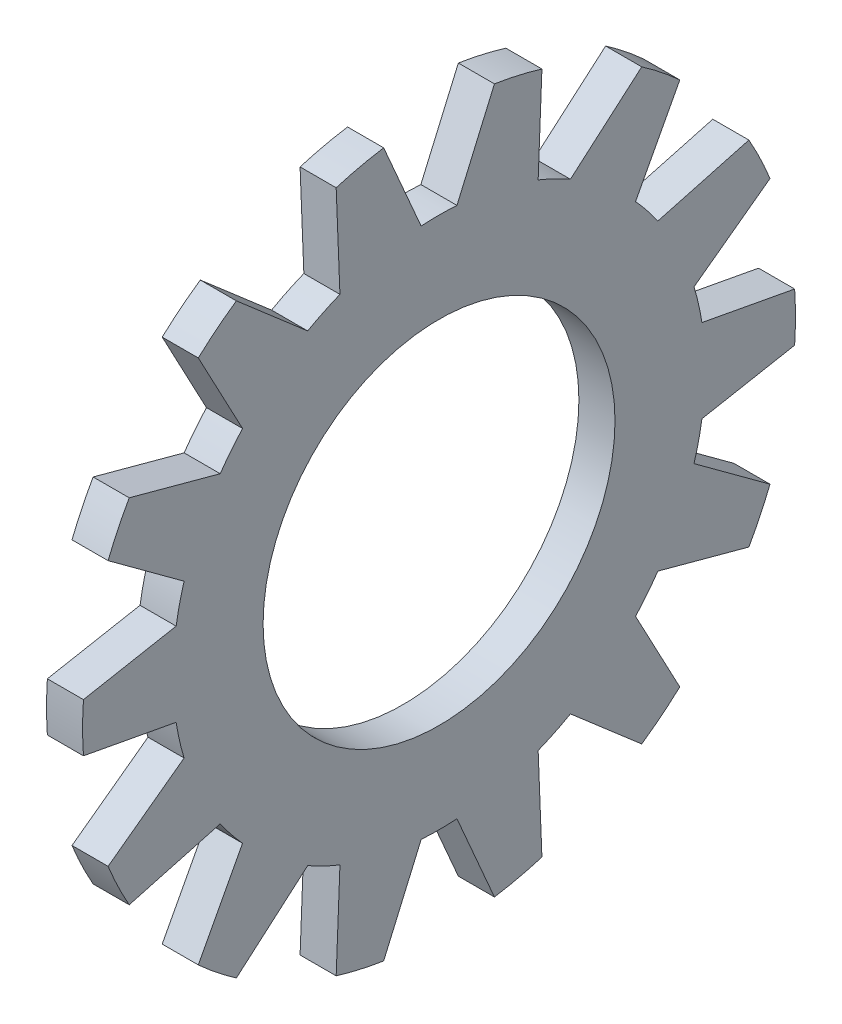
from build123d import *

# Parameters (mm, degrees)
SECSKE_W      = 0.508
SECSKE_H      = 2.54
EXTCUT_DEPTH  = 8.112566942
EXTCUTS_COUNT = 14


with BuildPart() as part:
    # SecSke → Body (revolve)
    with BuildSketch(Plane.XY, mode=Mode.PRIVATE) as body_sk:
        with Locations((-0.254, 3.7465)):
            Rectangle(SECSKE_W, SECSKE_H)
    revolve(body_sk.sketch.rotate(Axis((-34.925, 0, 0), (1, 0, 0)), 90), axis=Axis((-34.925, 0, 0), (1, 0, 0)))

    # ExtCutSke → ExtCut (cut, through all)
    with BuildSketch(Plane(origin=(0, 0, 0), x_dir=(0, 0, -1), z_dir=(1, 0, 0))):
        with BuildLine():
            Line((-0.882309718, 5.192903063), (-0.25202333, 3.738013709))
            ThreePointArc((-0.25202333, 3.738013709), (0, 3.7465), (0.25202333, 3.738013709))
            Line((0.25202333, 3.738013709), (0.882309718, 5.192903063))
            ThreePointArc((0.882309718, 5.192903063), (0, 5.267325), (-0.882309718, 5.192903063))
        make_face()
    extcut = extrude(amount=-EXTCUT_DEPTH, mode=Mode.SUBTRACT)

    # ExtCuts: ExtCut ×14 about axis
    extcuts_axis = Axis((0, 0, 0), (1, 0, 0))
    for i in range(1, EXTCUTS_COUNT):
        add(extcut.rotate(extcuts_axis, i * 360 / EXTCUTS_COUNT), mode=Mode.SUBTRACT)


solid = part.part
